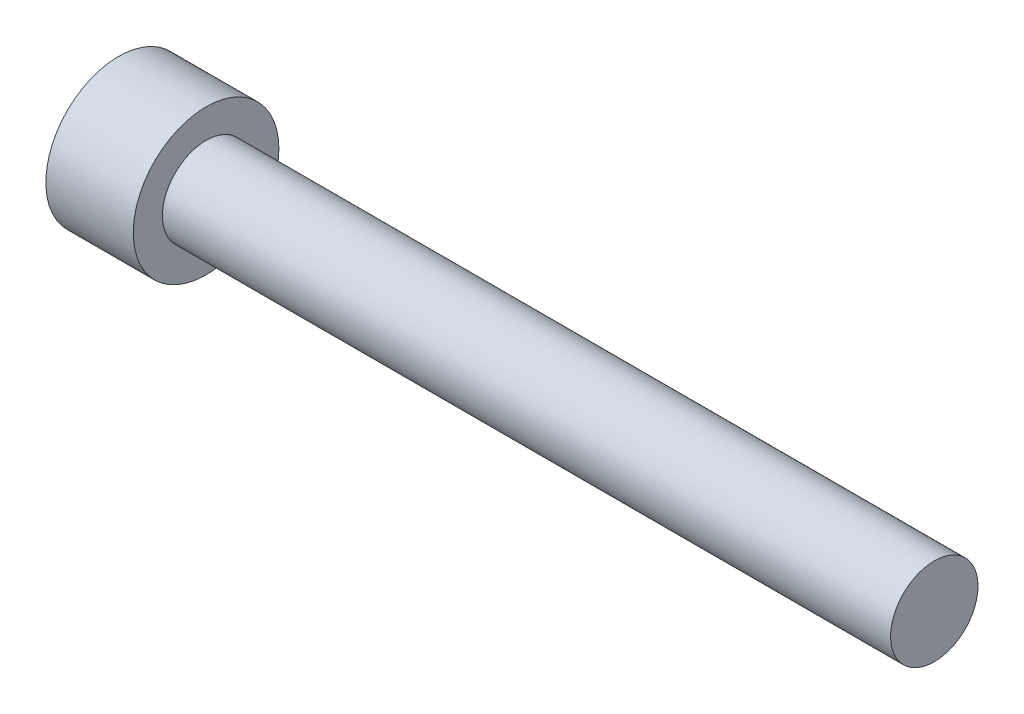
from build123d import *


with BuildPart() as part:
    # Sketch1 → Revolve1 (revolve)
    with BuildSketch(Plane(origin=(0, 0, 0), x_dir=(1, 0, 0), z_dir=(0, 1, 0))):
        Polygon((0, 0), (0, 2.5), (3, 2.5), (3, 1.5), (28, 1.5), (28, 0), align=None)
    revolve(axis=Axis((28, 0, 0), (-1, 0, 0)))


solid = part.part
